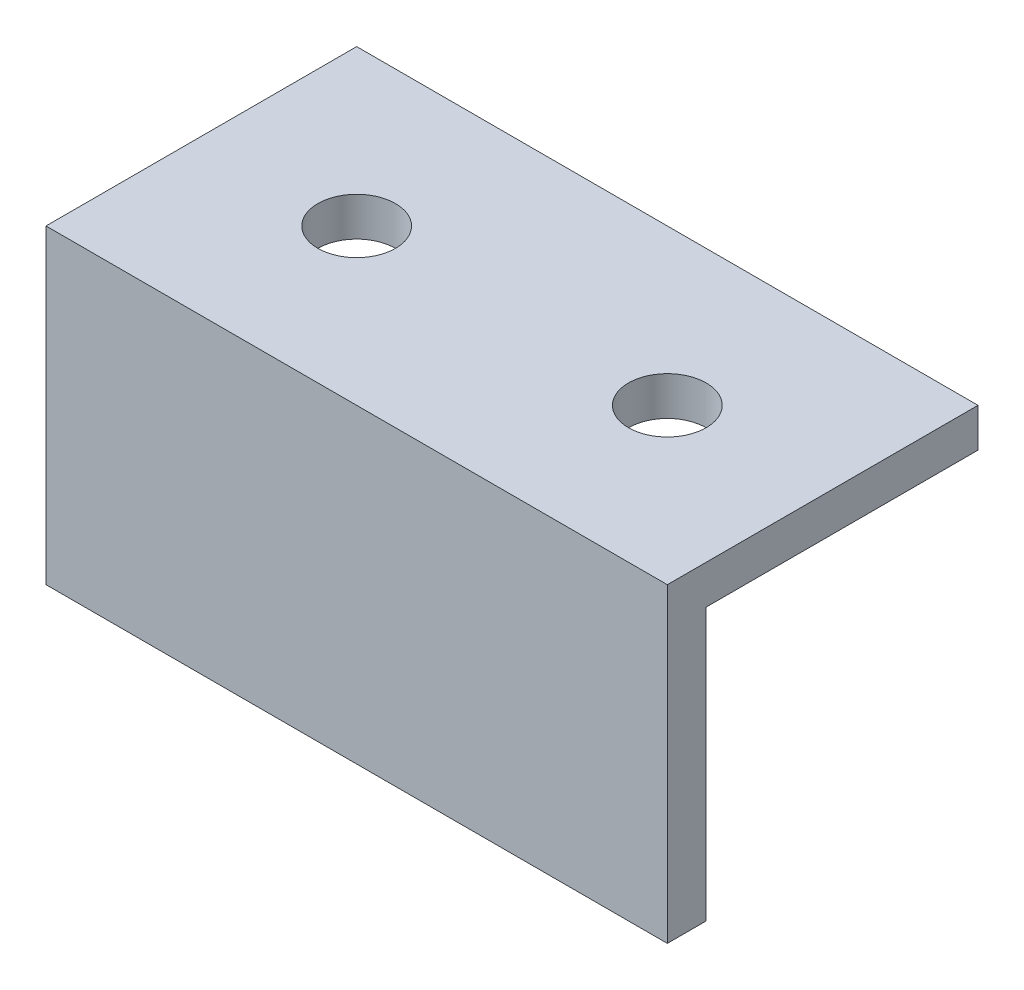
from build123d import *

# Parameters (mm, degrees)
EXTRUDE1_DEPTH = 25.4
SKETCH2_R      = 1.5875
EXTRUDE2_DEPTH = 20.686644236


with BuildPart() as part:
    # Sketch1 → Extrude1 (new body)
    with BuildSketch(Plane(origin=(0, 0, 0), x_dir=(0, 0, -1), z_dir=(1, 0, 0))):
        Polygon((0, 0), (0, 12.7), (12.7, 12.7), (12.7, 11.1125), (1.5875, 11.1125), (1.5875, 0), align=None)
    extrude(amount=EXTRUDE1_DEPTH)

    # Sketch2 → Extrude2 (cut)
    with BuildSketch(Plane(origin=(0, 12.7, 0), x_dir=(1, 0, 0), z_dir=(0, 1, 0))):
        with Locations(Location((19.05, 6.35, 0), (0, 0, 270))):
            Circle(SKETCH2_R)
        with Locations(Location((6.35, 6.35, 0), (0, 0, 270))):
            Circle(SKETCH2_R)
    extrude(amount=-EXTRUDE2_DEPTH, mode=Mode.SUBTRACT)


solid = part.part
